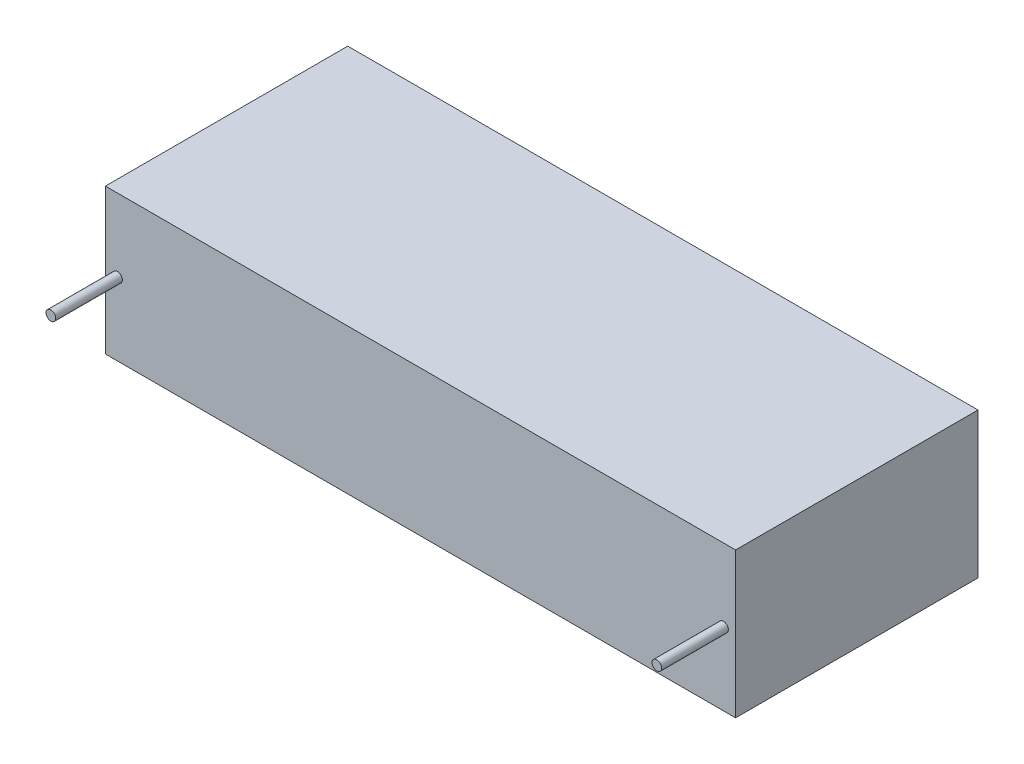
from build123d import *

# Parameters (mm, degrees)
SKETCH_1_W      = 52
SKETCH_1_H      = 12
EXTRUDE_1_DEPTH = 20
SKETCH_2_R      = 0.4
EXTRUDE_2_DEPTH = 5.5


with BuildPart() as part:
    # Эскиз1 → Вытянуть1 (new body)
    with BuildSketch(Plane.XY):
        with Locations((26, 6)):
            Rectangle(SKETCH_1_W, SKETCH_1_H)
    extrude(amount=EXTRUDE_1_DEPTH)

    # Эскиз2 → Вытянуть2 (add)
    with BuildSketch(Plane.XY.offset(20)):
        with Locations(Location((1, 6, 0), (0, 0, 180))):
            Circle(SKETCH_2_R)
        with Locations(Location((51, 6, 0), (0, 0, 180))):
            Circle(SKETCH_2_R)
    extrude(amount=EXTRUDE_2_DEPTH)


solid = part.part
